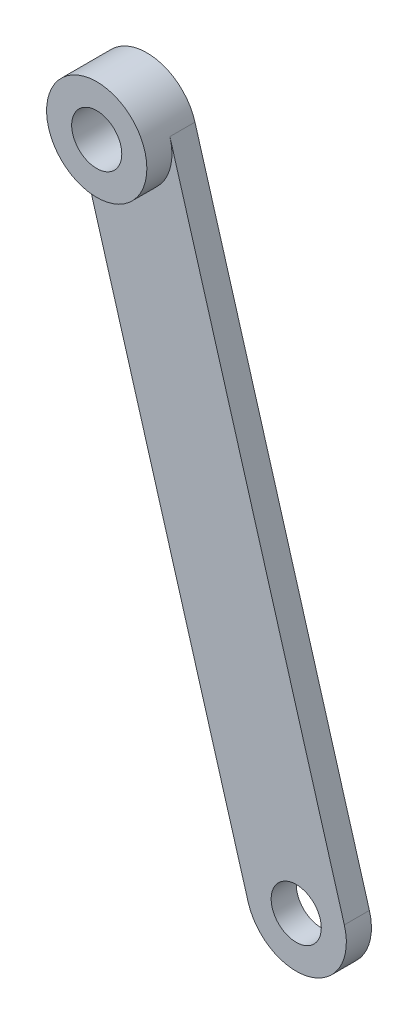
from build123d import *

# Parameters (mm, degrees)
SKETCH1_R           = 1.5875
BOSS_EXTRUDE1_DEPTH = 1.5875
SKETCH2_R           = 3.175
SKETCH2_R_2         = 1.5875
BOSS_EXTRUDE2_DEPTH = 1.5875


with BuildPart() as part:
    # Sketch1 → Boss-Extrude1 (new body)
    with BuildSketch(Plane.XY):
        with BuildLine():
            Line((-34.953036507, -6.90745394), (-23.905143538, -44.62262411))
            ThreePointArc((-23.905143538, -44.62262411), (-26.059560971, -48.562133663), (-29.999070525, -46.407716231))
            Line((-29.999070525, -46.407716231), (-41.046963493, -8.69254606))
            ThreePointArc((-41.046963493, -8.69254606), (-38.89254606, -4.753036507), (-34.953036507, -6.90745394))
        make_face()
        with Locations((-26.952107032, -45.51517017)):
            Circle(SKETCH1_R, mode=Mode.SUBTRACT)
        with Locations((-38, -7.8)):
            Circle(SKETCH1_R, mode=Mode.SUBTRACT)
    extrude(amount=BOSS_EXTRUDE1_DEPTH)

    # Sketch2 → Boss-Extrude2 (add)
    with BuildSketch(Plane.XY.offset(1.5875)):
        with Locations(Location((-38, -7.8, 0), (0, 0, 196.32687427))):
            Circle(SKETCH2_R)
        with Locations((-38, -7.8)):
            Circle(SKETCH2_R_2, mode=Mode.SUBTRACT)
    extrude(amount=BOSS_EXTRUDE2_DEPTH)


solid = part.part
